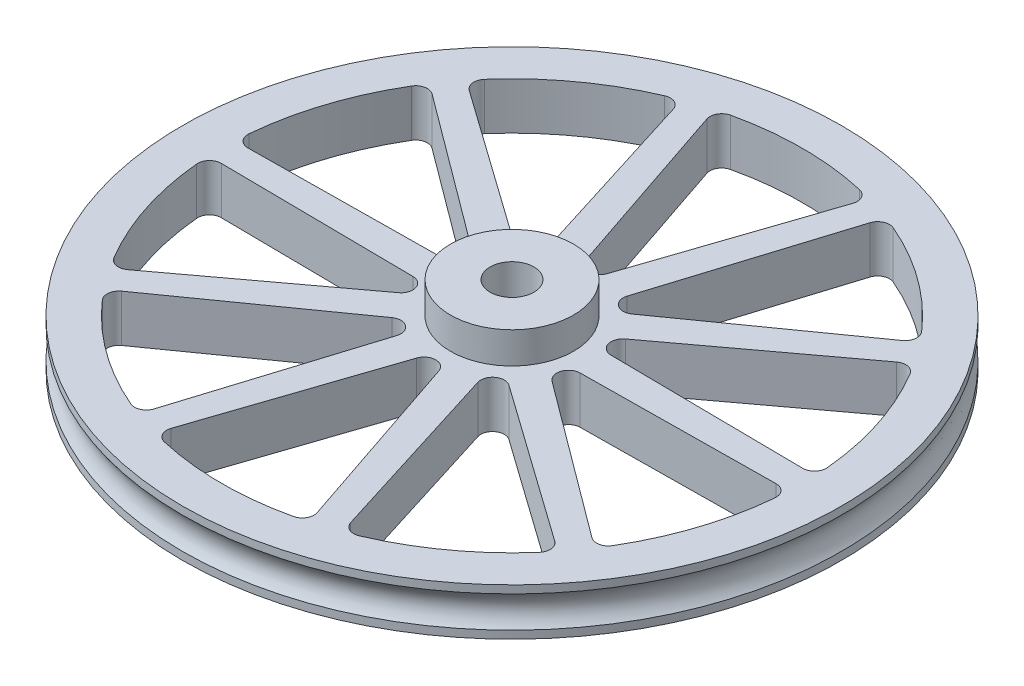
from build123d import *

# Parameters (mm, degrees)
BOSS_EXTRUDE1_DEPTH = 3
CIRPATTERN1_COUNT   = 10
BOSS_EXTRUDE2_DEPTH = 3
CIRPATTERN3_COUNT   = 10


with BuildPart() as part:
    # Sketch2 → Revolve1 (revolve)
    with BuildSketch(Plane.XY, mode=Mode.PRIVATE) as revolve1_sk:
        Polygon((2.841205436, -5), (7.841205436, -5), (7.841205436, 5), (2.794, 5), (2.794, 0), (1.5, 0), (1.5, -5), align=None)
        with BuildLine():
            Line((42, -4), (42, -5))
            Line((42, -5), (37, -5))
            Line((37, -5), (37, 1))
            Line((37, 1), (42, 1))
            Line((42, 1), (42, 0))
            add(Edge.make_bspline(
                [(42, 0), (40.4125, -2), (42, -4)],
                knots=[0, 0, 0, 1, 1, 1], degree=2))
        make_face()
    revolve(revolve1_sk.sketch.rotate(Axis((0, 0, 0), (0, 1, 0)), 90), axis=Axis((0, 0, 0), (0, 1, 0)))

    # Sketch3 → Boss-Extrude1 (add, symmetric)
    with BuildSketch(Plane(origin=(0, -2, 0), x_dir=(1, 0, 0), z_dir=(0, 1, 0))):
        with BuildLine():
            Line((7.581853512, 2), (36.961862454, 1.679501106))
            ThreePointArc((36.961862454, 1.679501106), (37, 0), (36.961862454, -1.679501106))
            Line((36.961862454, -1.679501106), (7.581853512, -2))
            ThreePointArc((7.581853512, -2), (7.841205436, 0), (7.581853512, 2))
        make_face()
    boss_extrude1 = extrude(amount=BOSS_EXTRUDE1_DEPTH, both=True)

    # CirPattern1: Boss-Extrude1 ×10 about axis
    cirpattern1_axis = Axis((0, 0, 0), (0, 1, 0))
    for i in range(1, CIRPATTERN1_COUNT):
        add(boss_extrude1.rotate(cirpattern1_axis, i * 360 / CIRPATTERN1_COUNT))

    # Sketch4 → Boss-Extrude2 (add, symmetric)
    with BuildSketch(Plane(origin=(0, -2, 0), x_dir=(1, 0, 0), z_dir=(0, 1, 0))):
        with BuildLine():
            Line((4.958277836, -6.074535668), (7.461905948, -7.852127938))
            ThreePointArc((7.461905948, -7.852127938), (5.711839894, -7.861673162), (5.161961694, -9.523135251))
            Line((5.161961694, -9.523135251), (4.245034617, -6.5927372))
            ThreePointArc((4.245034617, -6.5927372), (4.608944915, -6.343668454), (4.958277836, -6.074535668))
        make_face()
        with BuildLine():
            Line((13.019144113, -34.633825757), (12.534602349, -33.085283591))
            ThreePointArc((12.534602349, -33.085283591), (13.338668476, -33.999791988), (14.556277797, -34.016389825))
            ThreePointArc((14.556277797, -34.016389825), (13.791166744, -34.333711128), (13.019144113, -34.633825757))
        make_face()
        with BuildLine():
            Line((27.592569409, -22.145030136), (28.915588887, -23.084382585))
            ThreePointArc((28.915588887, -23.084382585), (28.391594801, -23.725879218), (27.853371989, -24.355485395))
            ThreePointArc((27.853371989, -24.355485395), (28.213848481, -23.192341103), (27.592569409, -22.145030136))
        make_face()
    boss_extrude2 = extrude(amount=BOSS_EXTRUDE2_DEPTH, both=True)

    # CirPattern3: Boss-Extrude2 ×10 about axis
    cirpattern3_axis = Axis((0, 0, 0), (0, 1, 0))
    for i in range(1, CIRPATTERN3_COUNT):
        add(boss_extrude2.rotate(cirpattern3_axis, i * 360 / CIRPATTERN3_COUNT))


solid = part.part
